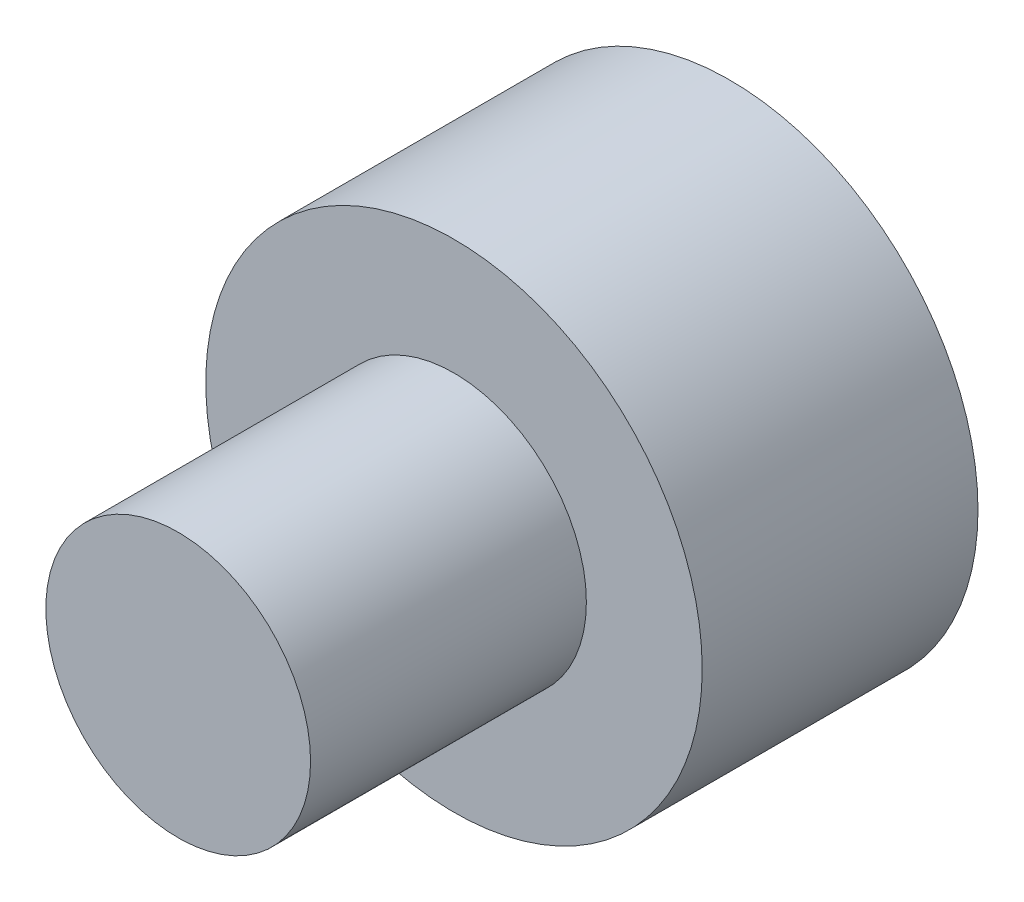
from build123d import *

# Parameters (mm, degrees)
SKETCH_1_R      = 2.25
EXTRUDE_1_DEPTH = 2.5
SKETCH_2_R      = 1.2
EXTRUDE_2_DEPTH = 2.5


with BuildPart() as part:
    # Эскиз1 → Бобышка-Вытянуть1 (new body)
    with BuildSketch(Plane.XY):
        Circle(SKETCH_1_R)
    extrude(amount=EXTRUDE_1_DEPTH)

    # Эскиз2 → Бобышка-Вытянуть2 (add)
    with BuildSketch(Plane.XY.offset(2.5)):
        Circle(SKETCH_2_R)
    extrude(amount=EXTRUDE_2_DEPTH)


solid = part.part
